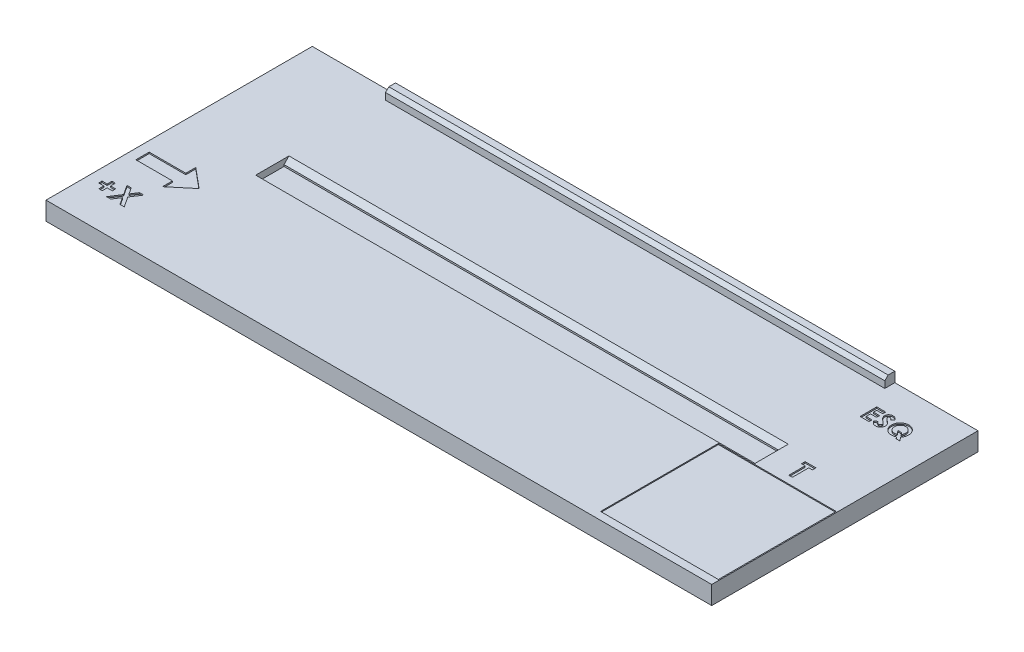
from build123d import *

# Parameters (mm, degrees)
CROQUIS1_W              = 200
CROQUIS1_H              = 80
SALIENTE_EXTRUIR1_DEPTH = 6
CROQUIS4_W              = 150
CROQUIS4_H              = 7
CORTAR_EXTRUIR3_DEPTH   = 2
CROQUIS5_W              = 150
CROQUIS5_H              = 3
SALIENTE_EXTRUIR2_DEPTH = 3
CROQUIS8_R              = 5.2
CORTAR_EXTRUIR5_DEPTH   = 3.2
CROQUIS9_R              = 5.2
CORTAR_EXTRUIR6_DEPTH   = 4.5
CROQUIS10_R             = 5
CORTAR_EXTRUIR7_DEPTH   = 1
CROQUIS11_W             = 35.4
CROQUIS11_H             = 35.4
CORTAR_EXTRUIR8_DEPTH   = 0.3
CHAFL_N1_SIZE           = 1.5
CHAFL_N2_SIZE           = 1
CHAFL_N5_SIZE           = 0.5
CORTAR_EXTRUIR9_DEPTH   = 0.4
CORTAR_EXTRUIR11_DEPTH  = 0.4
CORTAR_EXTRUIR13_DEPTH  = 0.4
CORTAR_EXTRUIR14_DEPTH  = 0.4


with BuildPart() as part:
    # Croquis1 → Saliente-Extruir1 (new body)
    with BuildSketch(Plane(origin=(0, 0, 0), x_dir=(1, 0, 0), z_dir=(0, 1, 0))):
        Rectangle(CROQUIS1_W, CROQUIS1_H)
    extrude(amount=-SALIENTE_EXTRUIR1_DEPTH)

    # Croquis4 → Cortar-Extruir3 (cut)
    with BuildSketch(Plane(origin=(0, 0, 0), x_dir=(1, 0, 0), z_dir=(0, 1, 0))):
        with Locations((0, 3)):
            Rectangle(CROQUIS4_W, CROQUIS4_H)
    extrude(amount=-CORTAR_EXTRUIR3_DEPTH, mode=Mode.SUBTRACT)

    # Croquis5 → Saliente-Extruir2 (add)
    with BuildSketch(Plane(origin=(0, 0, 0), x_dir=(1, 0, 0), z_dir=(0, 1, 0))):
        with Locations((0, 38.5)):
            Rectangle(CROQUIS5_W, CROQUIS5_H)
    extrude(amount=SALIENTE_EXTRUIR2_DEPTH)

    # Croquis8 → Cortar-Extruir5 (cut)
    with BuildSketch(Plane(origin=(0, -6, 0), x_dir=(1, 0, 0), z_dir=(0, 1, 0))):
        with Locations(Location((-50, 3, 0), (0, 0, 270))):
            Circle(CROQUIS8_R)
        with Locations(Location((0, 3, 0), (0, 0, 270))):
            Circle(CROQUIS8_R)
        with Locations(Location((50, 3, 0), (0, 0, 270))):
            Circle(CROQUIS8_R)
    extrude(amount=CORTAR_EXTRUIR5_DEPTH, mode=Mode.SUBTRACT)

    # Croquis9 → Cortar-Extruir6 (cut)
    with BuildSketch(Plane(origin=(0, -6, 0), x_dir=(1, 0, 0), z_dir=(0, 1, 0))):
        with Locations(Location((-50, 34, 0), (0, 0, 270))):
            Circle(CROQUIS9_R)
        with Locations(Location((0, 34, 0), (0, 0, 270))):
            Circle(CROQUIS9_R)
        with Locations(Location((50, 34, 0), (0, 0, 270))):
            Circle(CROQUIS9_R)
    extrude(amount=CORTAR_EXTRUIR6_DEPTH, mode=Mode.SUBTRACT)

    # Croquis10 → Cortar-Extruir7 (cut)
    with BuildSketch(Plane(origin=(0, -6, 0), x_dir=(1, 0, 0), z_dir=(0, 1, 0))):
        with Locations(Location((90, 32, 0), (0, 0, 270))):
            Circle(CROQUIS10_R)
        with Locations(Location((90, -32, 0), (0, 0, 270))):
            Circle(CROQUIS10_R)
        with Locations(Location((-90, 32, 0), (0, 0, 270))):
            Circle(CROQUIS10_R)
        with Locations(Location((-90, -32, 0), (0, 0, 270))):
            Circle(CROQUIS10_R)
    extrude(amount=CORTAR_EXTRUIR7_DEPTH, mode=Mode.SUBTRACT)

    # Croquis11 → Cortar-Extruir8 (cut)
    with BuildSketch(Plane(origin=(0, 0, 0), x_dir=(1, 0, 0), z_dir=(0, 1, 0))):
        with Locations((82, -20)):
            Rectangle(CROQUIS11_W, CROQUIS11_H)
    extrude(amount=-CORTAR_EXTRUIR8_DEPTH, mode=Mode.SUBTRACT)

    # Chaflán1
    chafl_n1_edges = [part.edges().sort_by_distance(p)[0] for p in [
        (0, 0, 0.5),
        (0, 0, -6.5),
    ]]
    chamfer(chafl_n1_edges, length=CHAFL_N1_SIZE)

    # Chaflán2
    chafl_n2_edges = [part.edges().sort_by_distance(p)[0] for p in [
        (0, 3, -37),
    ]]
    chamfer(chafl_n2_edges, length=CHAFL_N2_SIZE)

    # Chaflán5
    chafl_n5_edges = [part.edges().sort_by_distance(p)[0] for p in [
        (-100, -6, 0),
        (0, -6, 40),
        (100, -6, 0),
        (0, -6, -40),
    ]]
    chamfer(chafl_n5_edges, length=CHAFL_N5_SIZE)

    # Croquis12 → Cortar-Extruir9 (cut)
    with BuildSketch(Plane(origin=(0, 0, 0), x_dir=(1, 0, 0), z_dir=(0, 1, 0))):
        Polygon((-97, -16), (-86, -16), (-86, -19), (-80, -14), (-86, -9), (-86, -12), (-97, -12), align=None)
    extrude(amount=-CORTAR_EXTRUIR9_DEPTH, mode=Mode.SUBTRACT)

    # Croquis14 → Cortar-Extruir11 (cut)
    with BuildSketch(Plane(origin=(0, 0, 0), x_dir=(1, 0, 0), z_dir=(0, 1, 0))):
        Polygon((82.076923077, 6), (85.307692308, 6), (85.307692308, 4.923076923), (84.230769231, 4.923076923), (84.230769231, 0), (83.153846154, 0), (83.153846154, 4.923076923), (82.076923077, 4.923076923), align=None)
    extrude(amount=-CORTAR_EXTRUIR11_DEPTH, mode=Mode.SUBTRACT)

    # Croquis16 → Cortar-Extruir13 (cut)
    with BuildSketch(Plane(origin=(0, 0, 0), x_dir=(1, 0, 0), z_dir=(0, 1, 0))):
        Polygon((-95, -26.615384615), (-95, -25.153846154), (-94, -25.153846154), (-94, -26.615384615), (-92.461538462, -26.615384615), (-92.461538462, -27.615384615), (-94, -27.615384615), (-94, -29.076923077), (-95, -29.076923077), (-95, -27.615384615), (-96.538461538, -27.615384615), (-96.538461538, -26.615384615), align=None)
        Polygon((-91.674278846, -24), (-90.405048077, -24), (-89.151442308, -25.926682692), (-87.895432692, -24), (-86.625, -24), (-88.516826923, -26.901442308), (-86.5, -30), (-87.769230769, -30), (-89.151442308, -27.875), (-90.537259615, -30), (-91.807692308, -30), (-89.786057692, -26.900240385), align=None)
    extrude(amount=-CORTAR_EXTRUIR13_DEPTH, mode=Mode.SUBTRACT)

    # Croquis17 → Cortar-Extruir14 (cut)
    # profile 1 of 3: a face of its own
    with BuildSketch(Plane(origin=(0, 0, 0), x_dir=(1, 0, 0), z_dir=(0, 1, 0))):
        Polygon((78.576923077, 31), (81.269230769, 31), (81.269230769, 30.102564103), (79.474358974, 30.102564103), (79.474358974, 29.141025641), (81.269230769, 29.141025641), (81.269230769, 28.243589744), (79.474358974, 28.243589744), (79.474358974, 26.897435897), (81.269230769, 26.897435897), (81.269230769, 26), (78.576923077, 26), align=None)
    # profile 2 of 3: a face of its own
    with BuildSketch(Plane(origin=(0, 0, 0), x_dir=(1, 0, 0), z_dir=(0, 1, 0))):
        with BuildLine():
            Line((84.730769231, 30.33193109), (84.059695513, 29.717948718))
            add(Edge.make_bspline(
                [(84.059695513, 29.717948718), (84.030949592, 29.758497827), (83.975761433, 29.836346463), (83.886307184, 29.94058762), (83.797256867, 30.029513085), (83.707785485, 30.102751368), (83.617099997, 30.159857492), (83.52535782, 30.200289258), (83.433079066, 30.225992116), (83.371081989, 30.22919274), (83.340544872, 30.230769231)],
                knots=[0, 0, 0, 0, 1.299362458, 2.494594718, 3.587462134, 4.587049575, 5.512617175, 6.380583204, 7.202344345, 8, 8, 8, 8], degree=3))
            add(Edge.make_bspline(
                [(83.340544872, 30.230769231), (83.312060725, 30.229770294), (83.257065322, 30.227841609), (83.178665294, 30.208670625), (83.109060634, 30.175584321), (83.04831927, 30.132321196), (83.000203149, 30.080199161), (82.961786157, 30.025536547), (82.940154163, 29.965201384), (82.937306967, 29.923760759), (82.935897436, 29.903245192)],
                knots=[0, 0, 0, 0, 1.185010067, 2.2879431, 3.333075148, 4.379039566, 5.372662701, 6.27520591, 7.14612461, 8, 8, 8, 8], degree=3))
            add(Edge.make_bspline(
                [(82.935897436, 29.903245192), (82.936780717, 29.882433782), (82.938559524, 29.840522492), (82.955740372, 29.779096278), (82.981636817, 29.719075717), (83.006381926, 29.682538345), (83.019030449, 29.663862179)],
                knots=[0, 0, 0, 0, 0.967525499, 1.948461899, 2.951351359, 4, 4, 4, 4], degree=3))
            add(Edge.make_bspline(
                [(83.019030449, 29.663862179), (83.030529324, 29.649345391), (83.056998216, 29.615929662), (83.107468972, 29.563004356), (83.170849641, 29.498166224), (83.249579247, 29.423644859), (83.340389505, 29.33676018), (83.447489588, 29.240927659), (83.56779669, 29.133179473), (83.653308191, 29.058147537), (83.698116987, 29.018830128)],
                knots=[0, 0, 0, 0, 0.473873513, 1.090794244, 1.870441696, 2.795289791, 3.865433203, 5.087734844, 6.473946851, 8, 8, 8, 8], degree=3))
            add(Edge.make_bspline(
                [(83.698116987, 29.018830128), (83.740176488, 28.982429752), (83.819996682, 28.9133494), (83.933564967, 28.815300932), (84.033372576, 28.727089116), (84.120873476, 28.650037823), (84.19474124, 28.583338608), (84.255286407, 28.52667265), (84.303248436, 28.48114313), (84.330512041, 28.453643273), (84.342147436, 28.441907051)],
                knots=[0, 0, 0, 0, 1.543621617, 2.929473131, 4.163658386, 5.240097082, 6.164993805, 6.925417477, 7.541396219, 8, 8, 8, 8], degree=3))
            add(Edge.make_bspline(
                [(84.342147436, 28.441907051), (84.386289699, 28.394135668), (84.471146632, 28.302302294), (84.58143073, 28.159989444), (84.672198111, 28.021063084), (84.742417477, 27.88290909), (84.795449967, 27.743534174), (84.832838575, 27.599520174), (84.855230861, 27.449362234), (84.857716928, 27.34689777), (84.858974359, 27.295072115)],
                knots=[0, 0, 0, 0, 1.206664779, 2.319633467, 3.337109185, 4.282041471, 5.190008762, 6.099243693, 7.03861361, 8, 8, 8, 8], degree=3))
            add(Edge.make_bspline(
                [(84.858974359, 27.295072115), (84.858079352, 27.24457437), (84.856323314, 27.145495916), (84.834815217, 27.000509355), (84.804145934, 26.861750924), (84.756725841, 26.730730511), (84.698930513, 26.605297455), (84.626475722, 26.487405604), (84.541387505, 26.375861845), (84.443863344, 26.27266016), (84.335990041, 26.179011783), (84.220285672, 26.095643786), (84.095618821, 26.026812885), (83.963054621, 25.970135548), (83.822664032, 25.926481906), (83.674614301, 25.894217795), (83.518678975, 25.874853385), (83.412048153, 25.872829065), (83.357572115, 25.871794872)],
                knots=[0, 0, 0, 0, 1.043214005, 2.046824704, 3.02475056, 3.976699089, 4.921714032, 5.875962561, 6.831408892, 7.817874052, 8.806269674, 9.781291748, 10.760897367, 11.74438705, 12.757449933, 13.795994037, 14.874007457, 16, 16, 16, 16], degree=3))
            add(Edge.make_bspline(
                [(83.357572115, 25.871794872), (83.31480889, 25.87255352), (83.230113179, 25.874056078), (83.105284505, 25.886323216), (82.98474831, 25.906121072), (82.868640366, 25.934497314), (82.756437587, 25.97045386), (82.648135364, 26.014373404), (82.544481344, 26.066936683), (82.444691231, 26.127062785), (82.349250129, 26.19687711), (82.256951222, 26.274952327), (82.16871131, 26.362489267), (82.084106596, 26.459280908), (82.003678404, 26.565601343), (81.92479403, 26.67996986), (81.850959333, 26.804508986), (81.805348356, 26.89187419), (81.782051282, 26.936498397)],
                knots=[0, 0, 0, 0, 1.016823716, 2.013894106, 2.979844003, 3.91962641, 4.853723003, 5.779685073, 6.695824784, 7.614987388, 8.547259901, 9.504950863, 10.487499108, 11.500346958, 12.559593716, 13.656357062, 14.802919212, 16, 16, 16, 16], degree=3))
            Line((81.782051282, 26.936498397), (82.571314103, 27.41025641))
            add(Edge.make_bspline(
                [(82.571314103, 27.41025641), (82.600455261, 27.359602105), (82.656321351, 27.262493472), (82.750991664, 27.132015716), (82.847976567, 27.020283117), (82.949518264, 26.929270554), (83.054382045, 26.857761073), (83.163074427, 26.806655436), (83.275671775, 26.775021105), (83.352367974, 26.771157823), (83.390625, 26.769230769)],
                knots=[0, 0, 0, 0, 1.283663364, 2.460892379, 3.537111102, 4.529833553, 5.449777664, 6.316464042, 7.160231139, 8, 8, 8, 8], degree=3))
            add(Edge.make_bspline(
                [(83.390625, 26.769230769), (83.429537873, 26.770804506), (83.505034513, 26.773857784), (83.612796307, 26.802059994), (83.711596399, 26.846339533), (83.796998469, 26.909520329), (83.869311558, 26.982440571), (83.922682768, 27.063567673), (83.956210922, 27.15134524), (83.959755661, 27.212321312), (83.961538462, 27.242988782)],
                knots=[0, 0, 0, 0, 1.13588714, 2.203786484, 3.234766741, 4.283437687, 5.291419208, 6.222934724, 7.106237994, 8, 8, 8, 8], degree=3))
            add(Edge.make_bspline(
                [(83.961538462, 27.242988782), (83.959892118, 27.271519872), (83.95654773, 27.329478051), (83.931913993, 27.415652543), (83.893403948, 27.501787845), (83.84784385, 27.57243835), (83.801480745, 27.631592103), (83.75714716, 27.682846153), (83.70316058, 27.739472906), (83.639657893, 27.801543594), (83.567478134, 27.86960464), (83.486560502, 27.94364938), (83.395978403, 28.023025568), (83.331954797, 28.077095843), (83.298477564, 28.10536859)],
                knots=[0, 0, 0, 0, 0.916159276, 1.861089862, 2.860218735, 3.940849679, 4.552606315, 5.27541173, 6.11797699, 7.06649574, 8.129236253, 9.306560635, 10.591630461, 12, 12, 12, 12], degree=3))
            add(Edge.make_bspline(
                [(83.298477564, 28.10536859), (83.234836012, 28.159215445), (83.112688611, 28.26256386), (82.940078836, 28.415206214), (82.784541974, 28.557864481), (82.647421407, 28.692302228), (82.526970008, 28.816036702), (82.424003526, 28.930072921), (82.339653094, 29.035290519), (82.250892453, 29.159913723), (82.166552098, 29.31177566), (82.093658097, 29.494483175), (82.046367546, 29.677167507), (82.041069298, 29.799811705), (82.038461538, 29.860176282)],
                knots=[0, 0, 0, 0, 1.345494975, 2.582412109, 3.71882943, 4.751509156, 5.681369928, 6.505683931, 7.230279997, 7.856715994, 8.973648664, 10.023341002, 11.027102913, 12, 12, 12, 12], degree=3))
            add(Edge.make_bspline(
                [(82.038461538, 29.860176282), (82.039546102, 29.9029836), (82.041682809, 29.987318614), (82.060742562, 30.111320964), (82.08922809, 30.230972813), (82.130597253, 30.345837616), (82.184289433, 30.455771501), (82.249496499, 30.56131264), (82.327230995, 30.661489655), (82.414832524, 30.756236138), (82.51134698, 30.842823641), (82.614484942, 30.919245789), (82.723662639, 30.983793046), (82.838212177, 31.037339683), (82.958843374, 31.078326232), (83.084667543, 31.10737954), (83.215865157, 31.124659522), (83.305102942, 31.127008535), (83.350560897, 31.128205128)],
                knots=[0, 0, 0, 0, 1.010766082, 1.991317756, 2.957454644, 3.913069143, 4.869106762, 5.843196583, 6.838735724, 7.860187025, 8.887984031, 9.89767229, 10.887916223, 11.879572884, 12.879850636, 13.892031539, 14.926195476, 16, 16, 16, 16], degree=3))
            add(Edge.make_bspline(
                [(83.350560897, 31.128205128), (83.409472158, 31.126050029), (83.526829655, 31.121756841), (83.700346099, 31.08818552), (83.869829707, 31.035391081), (84.006402774, 30.971700398), (84.115071415, 30.910003203), (84.198355777, 30.853200198), (84.283102098, 30.788129303), (84.369993805, 30.714585463), (84.457416315, 30.631183014), (84.547855468, 30.539907417), (84.640078921, 30.439969839), (84.700009543, 30.368574896), (84.730769231, 30.33193109)],
                knots=[0, 0, 0, 0, 1.282922637, 2.555718331, 3.837320111, 5.142675274, 5.830281639, 6.55870424, 7.337177975, 8.157850921, 9.037902056, 9.96903443, 10.957596896, 12, 12, 12, 12], degree=3))
        make_face()
    # profile 3 of 3: a face of its own
    with BuildSketch(Plane(origin=(0, 0, 0), x_dir=(1, 0, 0), z_dir=(0, 1, 0))):
        with BuildLine():
            Line((90.051282051, 26.712139423), (90.899639423, 25.615384615))
            Line((90.899639423, 25.615384615), (89.782852564, 25.615384615))
            Line((89.782852564, 25.615384615), (89.343149038, 26.183293269))
            add(Edge.make_bspline(
                [(89.343149038, 26.183293269), (89.297091427, 26.158214468), (89.20519346, 26.108175162), (89.061085325, 26.045776548), (88.914309489, 25.991035929), (88.762739128, 25.948141203), (88.607829448, 25.914377846), (88.448777798, 25.88859897), (88.285697984, 25.875006342), (88.17563631, 25.872870707), (88.120192308, 25.871794872)],
                knots=[0, 0, 0, 0, 0.985706899, 1.966764212, 2.949968678, 3.929638882, 4.925906056, 5.930211904, 6.957336097, 8, 8, 8, 8], degree=3))
            add(Edge.make_bspline(
                [(88.120192308, 25.871794872), (88.027901116, 25.873866348), (87.846883568, 25.877929288), (87.581778589, 25.916941475), (87.327994093, 25.975839276), (87.086472113, 26.061891976), (86.856398994, 26.171245779), (86.639613975, 26.306763673), (86.433595477, 26.464688372), (86.24338399, 26.646569778), (86.069343446, 26.84367212), (85.91727362, 27.053078473), (85.788004282, 27.271521649), (85.682581481, 27.499344314), (85.600604539, 27.736939231), (85.543196735, 27.983657451), (85.506801105, 28.239839939), (85.502289772, 28.413739005), (85.5, 28.502003205)],
                knots=[0, 0, 0, 0, 1.070144486, 2.098953612, 3.10240755, 4.088674545, 5.067611437, 6.052256776, 7.0494179, 8.074208254, 9.100739571, 10.09639475, 11.072322686, 12.041159829, 13.004031207, 13.983083054, 14.976293755, 16, 16, 16, 16], degree=3))
            add(Edge.make_bspline(
                [(85.5, 28.502003205), (85.500763321, 28.561145482), (85.502280299, 28.678681159), (85.520525252, 28.852867105), (85.546848923, 29.023637229), (85.585498765, 29.190073614), (85.633156671, 29.353397306), (85.693794821, 29.512309722), (85.764068764, 29.668319859), (85.844688532, 29.82013165), (85.93626172, 29.965500481), (86.033572172, 30.10558143), (86.141814635, 30.235876787), (86.257157935, 30.359320842), (86.379980933, 30.475832742), (86.512217907, 30.583010925), (86.651355987, 30.68351517), (86.798397691, 30.77523843), (86.950790329, 30.858147353), (87.107131307, 30.930200831), (87.266230671, 30.991841863), (87.428147781, 31.042055675), (87.593375155, 31.079685865), (87.760458924, 31.108337165), (87.930914153, 31.12427477), (88.045375491, 31.126886507), (88.103165064, 31.128205128)],
                knots=[0, 0, 0, 0, 1.035855852, 2.058595393, 3.065553363, 4.06176554, 5.050183643, 6.044349766, 7.039272903, 8.046842428, 9.053256483, 10.04817962, 11.033146707, 12.018200652, 13.007259073, 13.996749908, 14.99846043, 16.012935138, 17.03119782, 18.036301871, 19.027088812, 20.018894167, 21.003704893, 21.994284571, 22.987348552, 24, 24, 24, 24], degree=3))
            add(Edge.make_bspline(
                [(88.103165064, 31.128205128), (88.190436606, 31.125985973), (88.362405328, 31.121613125), (88.615370202, 31.084221334), (88.859314985, 31.024657113), (89.093233774, 30.938598484), (89.318556282, 30.830090045), (89.533036873, 30.695828175), (89.738945145, 30.538581555), (89.931832765, 30.358274675), (90.11008932, 30.162598291), (90.265486973, 29.952659338), (90.397040437, 29.732466237), (90.506750226, 29.501931202), (90.58940444, 29.259706926), (90.648409631, 29.007401625), (90.6857582, 28.744837794), (90.690100769, 28.565898254), (90.692307692, 28.474959936)],
                knots=[0, 0, 0, 0, 1.015551519, 2.00114601, 2.970254478, 3.93428303, 4.897362978, 5.876714212, 6.874912676, 7.909046156, 8.946527051, 9.952474942, 10.9443724, 11.928494229, 12.919233427, 13.917651329, 14.941735923, 16, 16, 16, 16], degree=3))
            add(Edge.make_bspline(
                [(90.692307692, 28.474959936), (90.690472948, 28.391062325), (90.686864367, 28.22605226), (90.655602221, 27.982793191), (90.606257272, 27.748324031), (90.535385889, 27.522478153), (90.445572389, 27.305501721), (90.3336645, 27.098040686), (90.204620583, 26.897632063), (90.102649714, 26.774278555), (90.051282051, 26.712139423)],
                knots=[0, 0, 0, 0, 1.049646143, 2.064447078, 3.064298101, 4.044929938, 5.022708814, 5.998521441, 6.991758374, 8, 8, 8, 8], degree=3))
        make_face()
        with BuildLine():
            add(Edge.make_bspline(
                [(89.462339744, 27.475360577), (89.489053591, 27.513659965), (89.541865819, 27.589376355), (89.608690339, 27.709472846), (89.666093356, 27.831909367), (89.713563404, 27.957328391), (89.749673815, 28.086448673), (89.77534028, 28.218427274), (89.792337075, 28.353324636), (89.79402247, 28.444192664), (89.794871795, 28.489983974)],
                knots=[0, 0, 0, 0, 1.031533623, 2.039301536, 3.033003023, 4.018477747, 4.999688364, 5.992485227, 6.988348989, 8, 8, 8, 8], degree=3))
            add(Edge.make_bspline(
                [(89.794871795, 28.489983974), (89.793291065, 28.549484771), (89.790179639, 28.666603015), (89.766810343, 28.838768558), (89.727660706, 29.003765332), (89.673072411, 29.161997187), (89.604327097, 29.313870301), (89.517968458, 29.458120067), (89.4165084, 29.595495695), (89.300926343, 29.7246742), (89.175087826, 29.842901129), (89.041255506, 29.947024312), (88.900347428, 30.034866842), (88.75228116, 30.105793949), (88.598662869, 30.1629207), (88.437843995, 30.201264469), (88.271226252, 30.226405245), (88.157678873, 30.2293019), (88.100160256, 30.230769231)],
                knots=[0, 0, 0, 0, 1.056263418, 2.079093448, 3.078410197, 4.062632158, 5.04680056, 6.032966551, 7.041959893, 8.074807684, 9.106532056, 10.103754224, 11.080880922, 12.048629763, 13.014470275, 13.984975, 14.979267944, 16, 16, 16, 16], degree=3))
            add(Edge.make_bspline(
                [(88.100160256, 30.230769231), (88.040985404, 30.229221027), (87.924516633, 30.22617383), (87.753530431, 30.202353849), (87.589518548, 30.164991321), (87.433343103, 30.110133674), (87.284531223, 30.04101184), (87.143089735, 29.956198006), (87.009727488, 29.855217261), (86.884127408, 29.741027415), (86.770643344, 29.614317916), (86.670430205, 29.478442849), (86.586554408, 29.333729855), (86.516311499, 29.181496755), (86.463433264, 29.02003881), (86.425769918, 28.850618834), (86.401968029, 28.672945431), (86.398967776, 28.551825684), (86.397435897, 28.489983974)],
                knots=[0, 0, 0, 0, 1.042613217, 2.052085894, 3.036973397, 4.002832266, 4.963730975, 5.924467509, 6.903642813, 7.907474205, 8.911719447, 9.896835452, 10.877830278, 11.85475743, 12.846581833, 13.865885605, 14.910357018, 16, 16, 16, 16], degree=3))
            add(Edge.make_bspline(
                [(86.397435897, 28.489983974), (86.399466489, 28.421449135), (86.403446111, 28.287132206), (86.431459688, 28.09119963), (86.479354719, 27.906140605), (86.548628769, 27.732954226), (86.634232863, 27.569202085), (86.742079391, 27.418371807), (86.867485079, 27.277481128), (86.964289187, 27.19547024), (87.013421474, 27.153846154)],
                knots=[0, 0, 0, 0, 1.078047314, 2.112794111, 3.106520711, 4.077995885, 5.041371964, 6.006121678, 6.988020189, 8, 8, 8, 8], degree=3))
            add(Edge.make_bspline(
                [(87.013421474, 27.153846154), (87.053621035, 27.123033754), (87.133340156, 27.061930165), (87.261043179, 26.984585344), (87.391931267, 26.917395553), (87.527242038, 26.863678045), (87.666508055, 26.820956721), (87.809699705, 26.791363493), (87.957096689, 26.772526136), (88.056699699, 26.770339037), (88.107171474, 26.769230769)],
                knots=[0, 0, 0, 0, 1.027457745, 2.037535419, 3.025615023, 4.011018129, 4.9886297, 5.978868484, 6.975833209, 8, 8, 8, 8], degree=3))
            add(Edge.make_bspline(
                [(88.107171474, 26.769230769), (88.165079864, 26.771074636), (88.280017361, 26.774734373), (88.449195147, 26.806613939), (88.614029202, 26.85429056), (88.717367105, 26.903024952), (88.769230769, 26.927483974)],
                knots=[0, 0, 0, 0, 1.010952568, 2.006554787, 2.999521277, 4, 4, 4, 4], degree=3))
            Line((88.769230769, 26.927483974), (87.900841346, 28.051282051))
            Line((87.900841346, 28.051282051), (89.017628205, 28.051282051))
            Line((89.017628205, 28.051282051), (89.462339744, 27.475360577))
        make_face(mode=Mode.SUBTRACT)
    extrude(amount=-CORTAR_EXTRUIR14_DEPTH, mode=Mode.SUBTRACT)


solid = part.part
